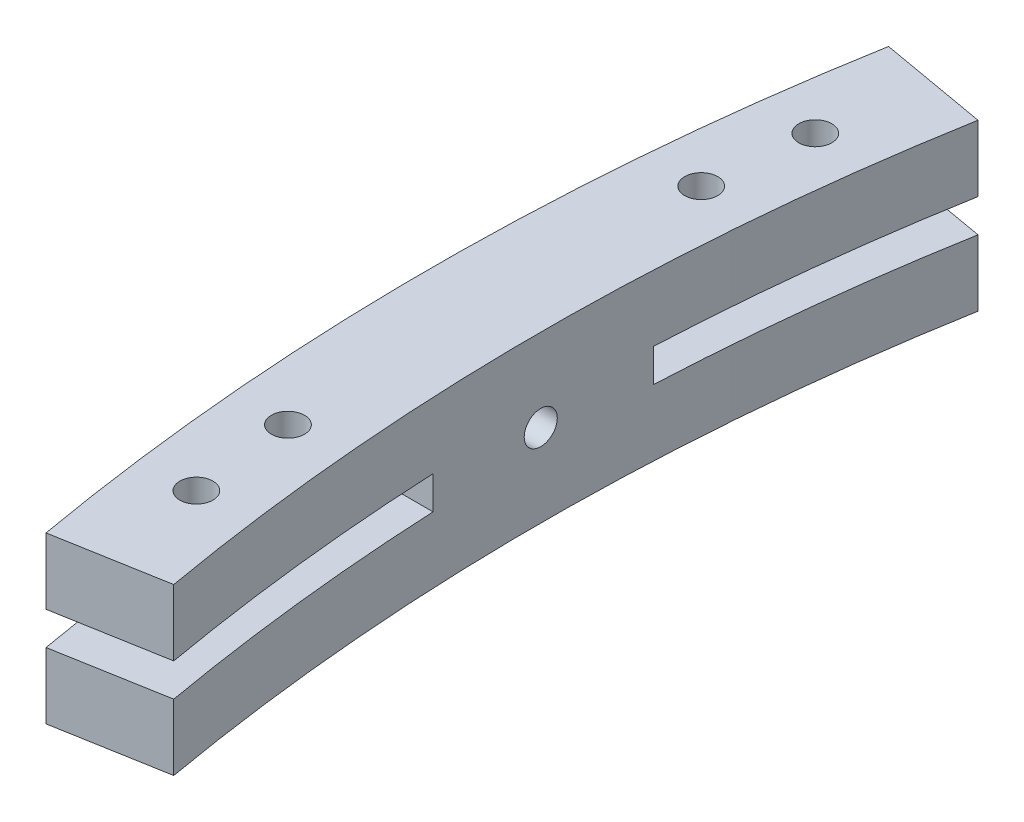
from build123d import *

# Parameters (mm, degrees)
BASE2_DEPTH            = 7.5
MOUNT2_START           = -1.5
MOUNT2_DEPTH           = 3
MOUNT_HOLE2_DEPTH      = 224.418192135
MOUNT_HOLE2_DEPTH_BACK = 224.418192135
SKETCH16_R             = 1.5
SKETCH17_R             = 1.5
SHAFT_HOLE_DEPTH       = 40.784051683
SKETCH18_W             = 2.5
SKETCH18_H             = 3


with BuildPart() as part:
    # Sketch13 → base2 (new, symmetric)
    with BuildSketch(Plane(origin=(0, 0, 0), x_dir=(1, 0, 0), z_dir=(0, 1, 0))):
        with BuildLine():
            ThreePointArc((-209.761769634, 10), (-208.70564487, 23.279901188), (-206.809628133, 36.46611731))
            Line((-206.809628133, 36.46611731), (-216.657705663, 38.202599087))
            ThreePointArc((-216.657705663, 38.202599087), (-218.670303662, 24.151569236), (-219.772609758, 10))
            Line((-219.772609758, 10), (-209.761769634, 10))
        make_face()
        with BuildLine():
            ThreePointArc((-209.761769634, -10), (-210, 0), (-209.761769634, 10))
            Line((-209.761769634, 10), (-219.772609758, 10))
            ThreePointArc((-219.772609758, 10), (-220, 0), (-219.772609758, -10))
            Line((-219.772609758, -10), (-209.761769634, -10))
        make_face()
        with BuildLine():
            Line((-216.657705663, -38.202599087), (-206.809628133, -36.46611731))
            ThreePointArc((-206.809628133, -36.46611731), (-208.70564487, -23.279901188), (-209.761769634, -10))
            Line((-209.761769634, -10), (-219.772609758, -10))
            ThreePointArc((-219.772609758, -10), (-218.670303662, -24.151569236), (-216.657705663, -38.202599087))
        make_face()
    extrude(amount=BASE2_DEPTH, both=True)

    # Sketch14 → mount2 (cut)
    with BuildSketch(Plane(origin=(0, 0, 0), x_dir=(1, 0, 0), z_dir=(0, 1, 0)).offset(MOUNT2_START)):
        with BuildLine():
            Line((-209.761769634, -10), (-219.772609758, -10))
            ThreePointArc((-219.772609758, -10), (-218.670303662, -24.151569236), (-216.657705663, -38.202599087))
            Line((-216.657705663, -38.202599087), (-206.809628133, -36.46611731))
            ThreePointArc((-206.809628133, -36.46611731), (-208.70564487, -23.279901188), (-209.761769634, -10))
        make_face()
        with BuildLine():
            Line((-209.761769634, 10), (-219.772609758, 10))
            ThreePointArc((-219.772609758, 10), (-218.670303662, 24.151569236), (-216.657705663, 38.202599087))
            Line((-216.657705663, 38.202599087), (-206.809628133, 36.46611731))
            ThreePointArc((-206.809628133, 36.46611731), (-208.70564487, 23.279901188), (-209.761769634, 10))
        make_face()
    extrude(amount=MOUNT2_DEPTH, mode=Mode.SUBTRACT)

    # Sketch16 → mount hole2 (cut, two sides: drawn at the far end of the back side and taken through both)
    with BuildSketch(Plane(origin=(0, 0, 0), x_dir=(1, 0, 0), z_dir=(0, 1, 0)).offset(-MOUNT_HOLE2_DEPTH_BACK)):
        with Locations(Location((-213.160645195, 28.063131327, 0), (0, 0, 270))):
            Circle(SKETCH16_R)
        with Locations(Location((-214.18186009, 18.738484691, 0), (0, 0, 270))):
            Circle(SKETCH16_R)
        with Locations(Location((-214.18186009, -18.738484691, 0), (0, 0, 270))):
            Circle(SKETCH16_R)
        with Locations(Location((-213.160645195, -28.063131327, 0), (0, 0, 270))):
            Circle(SKETCH16_R)
    extrude(amount=MOUNT_HOLE2_DEPTH + MOUNT_HOLE2_DEPTH_BACK, mode=Mode.SUBTRACT)

    # Sketch17 → shaft hole (cut, through all)
    with BuildSketch(Plane(origin=(-215, 0, 0), x_dir=(0, 0, -1), z_dir=(1, 0, 0))):
        with Locations(Location((0, 0, 0), (0, 0, 180))):
            Circle(SKETCH17_R)
    extrude(amount=SHAFT_HOLE_DEPTH, mode=Mode.SUBTRACT)

    # Sketch18 → Cut-Revolve1 (revolve, cut)
    with BuildSketch(Plane(origin=(0, 0, 0), x_dir=(1, 0, 0), z_dir=(0, 1, 0)), mode=Mode.PRIVATE) as cut_revolve1_sk:
        with Locations((-215, 1.5)):
            Rectangle(SKETCH18_W, SKETCH18_H)
    revolve(cut_revolve1_sk.sketch.rotate(Axis((-215, 0, 0), (1, 0, 0)), 180), axis=Axis((-215, 0, 0), (1, 0, 0)), mode=Mode.SUBTRACT)


solid = part.part
